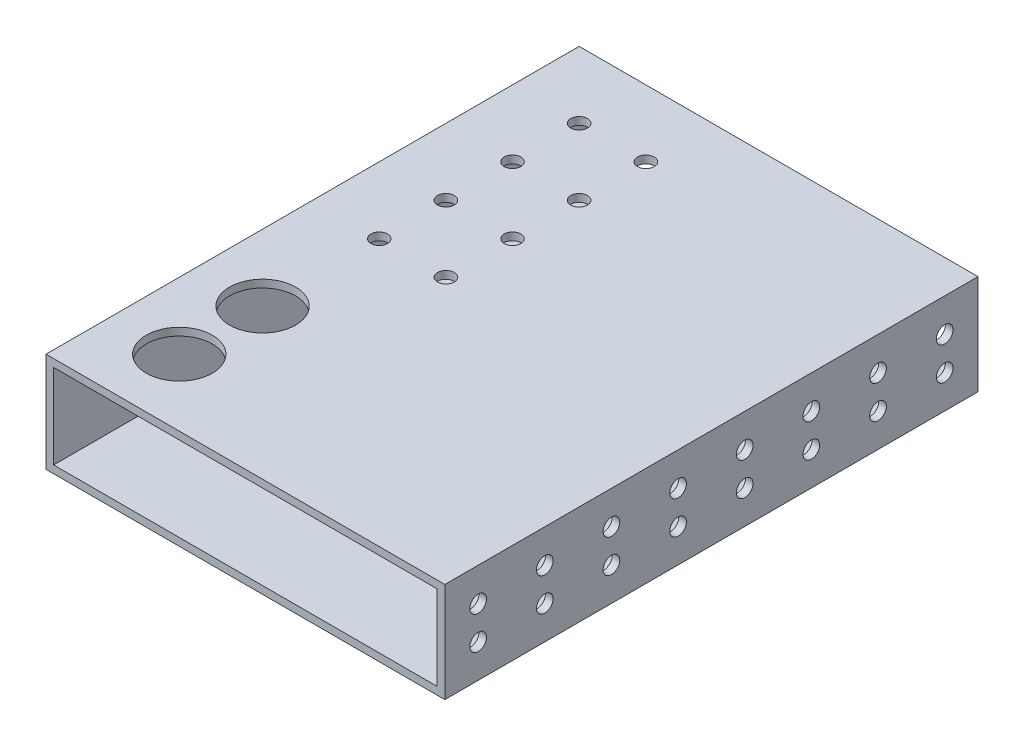
from build123d import *

# Parameters (mm, degrees)
SKETCH1_W           = 152.0063
SKETCH1_H           = 38.01618
SKETCH1_W_2         = 146.17954
SKETCH1_H_2         = 32.18942
BOSS_EXTRUDE1_DEPTH = 101.6
CUT_EXTRUDE1_START  = 16.09471
SKETCH2_R           = 12.578868564
SKETCH2_R_2         = 3.175
CUT_EXTRUDE1_DEPTH  = 2.91338
SKETCH3_R           = 3.175
CUT_EXTRUDE2_DEPTH  = 2.91338


with BuildPart() as part:
    # Sketch1 → Boss-Extrude1 (new, symmetric)
    with BuildSketch(Plane.XY):
        Rectangle(SKETCH1_W, SKETCH1_H)
        Rectangle(SKETCH1_W_2, SKETCH1_H_2, mode=Mode.SUBTRACT)
    extrude(amount=BOSS_EXTRUDE1_DEPTH, both=True)

    # Sketch2 (on Top Plane) → Cut-Extrude1 (cut)
    with BuildSketch(Plane(origin=(0, 0, 0), x_dir=(1, 0, 0), z_dir=(0, 1, 0)).offset(CUT_EXTRUDE1_START)):
        with Locations(Location((-50.60315, -76.2, 0), (0, 0, 270))):
            Circle(SKETCH2_R)
        with Locations(Location((-50.60315, -44.45, 0), (0, 0, 270))):
            Circle(SKETCH2_R)
        with Locations(Location((-50.60315, 76.2, 0), (0, 0, 270))):
            Circle(SKETCH2_R_2)
        with Locations(Location((-50.60315, 50.8, 0), (0, 0, 270))):
            Circle(SKETCH2_R_2)
        with Locations(Location((-50.60315, 25.4, 0), (0, 0, 270))):
            Circle(SKETCH2_R_2)
        with Locations(Location((-50.60315, 0, 0), (0, 0, 270))):
            Circle(SKETCH2_R_2)
        with Locations(Location((-25.20315, 76.2, 0), (0, 0, 270))):
            Circle(SKETCH2_R_2)
        with Locations(Location((-25.20315, 50.8, 0), (0, 0, 270))):
            Circle(SKETCH2_R_2)
        with Locations(Location((-25.20315, 25.4, 0), (0, 0, 270))):
            Circle(SKETCH2_R_2)
        with Locations(Location((-25.20315, 0, 0), (0, 0, 270))):
            Circle(SKETCH2_R_2)
    extrude(amount=CUT_EXTRUDE1_DEPTH, mode=Mode.SUBTRACT)

    # Sketch3 → Cut-Extrude2 (cut)
    with BuildSketch(Plane(origin=(76.00315, 0, 0), x_dir=(0, 0, -1), z_dir=(1, 0, 0))):
        with Locations((-12.7, 6.30809)):
            Circle(SKETCH3_R)
        with Locations((12.7, 6.30809)):
            Circle(SKETCH3_R)
        with Locations((38.1, 6.30809)):
            Circle(SKETCH3_R)
        with Locations((63.5, 6.30809)):
            Circle(SKETCH3_R)
        with Locations((88.9, 6.30809)):
            Circle(SKETCH3_R)
        with Locations((88.9, -6.30809)):
            Circle(SKETCH3_R)
        with Locations((63.5, -6.30809)):
            Circle(SKETCH3_R)
        with Locations((38.1, -6.30809)):
            Circle(SKETCH3_R)
        with Locations((12.7, -6.30809)):
            Circle(SKETCH3_R)
        with Locations((-12.7, -6.30809)):
            Circle(SKETCH3_R)
        with Locations((-38.1, -6.30809)):
            Circle(SKETCH3_R)
        with Locations((-63.5, -6.30809)):
            Circle(SKETCH3_R)
        with Locations((-88.9, -6.30809)):
            Circle(SKETCH3_R)
        with Locations((-88.9, 6.30809)):
            Circle(SKETCH3_R)
        with Locations((-63.5, 6.30809)):
            Circle(SKETCH3_R)
        with Locations((-38.1, 6.30809)):
            Circle(SKETCH3_R)
    extrude(amount=-CUT_EXTRUDE2_DEPTH, mode=Mode.SUBTRACT)


solid = part.part
